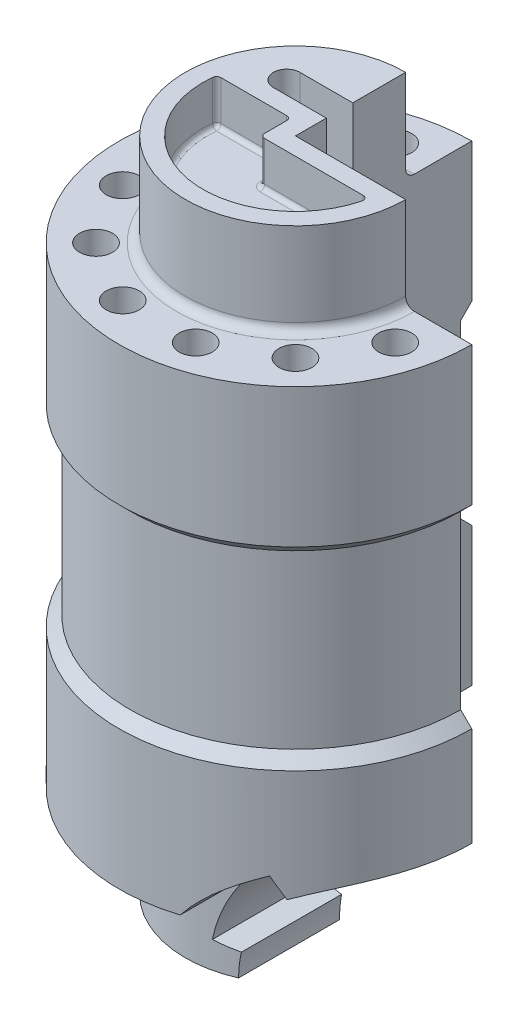
from build123d import *

# Parameters (mm, degrees)
SKETCH1_R               = 40
BOSS_EXTRUDE1_DEPTH     = 74.5
SKETCH3_R               = 40
SKETCH3_R_2             = 25
CUT_EXTRUDE1_DEPTH      = 21
CUT_EXTRUDE2_DEPTH      = 22
CUT_EXTRUDE2_DEPTH_BACK = 22
SKETCH2_R               = 40
SKETCH2_R_2             = 37.5
CUT_EXTRUDE4_DEPTH      = 160.376911753
FILLET1_R               = 2
CUT_EXTRUDE5_DEPTH      = 160.376911753
SKETCH8_R               = 3.75
CUT_EXTRUDE6_DEPTH      = 140.942845476
CUT_EXTRUDE7_DEPTH      = 94.542770966
CUT_EXTRUDE8_DEPTH      = 10
FILLET2_R               = 1
FILLET3_R               = 1


with BuildPart() as part:
    # Sketch1 → Boss-Extrude1 (new, symmetric)
    with BuildSketch(Plane(origin=(0, 0, 0), x_dir=(1, 0, 0), z_dir=(0, 1, 0))):
        with Locations(Location((0, 0, 0), (0, 0, 270))):
            Circle(SKETCH1_R)
    extrude(amount=BOSS_EXTRUDE1_DEPTH, both=True)

    # Sketch3 → Cut-Extrude1 (cut)
    with BuildSketch(Plane(origin=(0, 74.5, 0), x_dir=(1, 0, 0), z_dir=(0, 1, 0))):
        with Locations(Location((0, 0, 0), (0, 0, 270))):
            Circle(SKETCH3_R)
        with Locations(Location((0, 0, 0), (0, 0, 270))):
            Circle(SKETCH3_R_2, mode=Mode.SUBTRACT)
    cut_extrude1 = extrude(amount=-CUT_EXTRUDE1_DEPTH, mode=Mode.SUBTRACT)

    # Mirror1: Cut-Extrude1 across plane
    add(cut_extrude1.mirror(Plane.ZX), mode=Mode.SUBTRACT)

    # Sketch2 → Cut-Extrude2 (cut, two sides: drawn at the far end of the back side and taken through both)
    with BuildSketch(Plane(origin=(0, 0, 0), x_dir=(1, 0, 0), z_dir=(0, 1, 0)).offset(-CUT_EXTRUDE2_DEPTH_BACK)):
        with Locations(Location((0, 0, 0), (0, 0, 270))):
            Circle(SKETCH2_R)
        with Locations(Location((0, 0, 0), (0, 0, 90))):
            Circle(SKETCH2_R_2, mode=Mode.SUBTRACT)
    extrude(amount=CUT_EXTRUDE2_DEPTH + CUT_EXTRUDE2_DEPTH_BACK, mode=Mode.SUBTRACT)

    # Sketch5 → Cut-Extrude4 (cut, through all)
    with BuildSketch(Plane(origin=(0, 74.5, 0), x_dir=(1, 0, 0), z_dir=(0, 1, 0))):
        with BuildLine():
            Line((-12, 13), (12, 13))
            ThreePointArc((12, 13), (15, 10), (12, 7))
            Line((12, 7), (-12, 7))
            ThreePointArc((-12, 7), (-15, 10), (-12, 13))
        make_face()
    extrude(amount=-CUT_EXTRUDE4_DEPTH, mode=Mode.SUBTRACT)

    # Fillet1
    fillet1_edges = [part.edges().sort_by_distance(p)[0] for p in [
        (0, -53.5, -25),
        (0, 53.5, -25),
    ]]
    fillet(fillet1_edges, radius=FILLET1_R)

    # Sketch7 → Revolve2 (revolve)
    with BuildSketch(Plane(origin=(0, 0, 0), x_dir=(0, 0, -1), z_dir=(1, 0, 0))):
        Polygon((40, 22), (37.5, 19.5), (37.5, 22), align=None)
    revolve2 = revolve(axis=Axis((0, 103.881416882, 0), (0, -1, 0)))

    # Mirror2: Revolve2 across plane
    add(revolve2.mirror(Plane.ZX))

    # Sketch4 → Cut-Extrude5 (cut, through all)
    with BuildSketch(Plane(origin=(0, 74.5, 0), x_dir=(1, 0, 0), z_dir=(0, 1, 0))):
        with BuildLine():
            Line((0, 0), (0, 40))
            ThreePointArc((0, 40), (28.284271247, 28.284271247), (40, 0))
            Line((40, 0), (0, 0))
        make_face()
    extrude(amount=-CUT_EXTRUDE5_DEPTH, mode=Mode.SUBTRACT)

    # Sketch8 → Cut-Extrude6 (cut, through all)
    with BuildSketch(Plane(origin=(0, 53.5, 0), x_dir=(1, 0, 0), z_dir=(0, 1, 0))):
        with Locations(Location((-8.282209443, 30.909626441, 0), (0, 0, 270))):
            Circle(SKETCH8_R)
        with Locations(Location((30.909626441, -8.282209443, 0), (0, 0, 270))):
            Circle(SKETCH8_R)
        with Locations(Location((22.627416998, -22.627416998, 0), (0, 0, 270))):
            Circle(SKETCH8_R)
        with Locations(Location((8.282209443, -30.909626441, 0), (0, 0, 270))):
            Circle(SKETCH8_R)
        with Locations(Location((-8.282209443, -30.909626441, 0), (0, 0, 270))):
            Circle(SKETCH8_R)
        with Locations(Location((-22.627416998, -22.627416998, 0), (0, 0, 270))):
            Circle(SKETCH8_R)
        with Locations(Location((-30.909626441, -8.282209443, 0), (0, 0, 270))):
            Circle(SKETCH8_R)
        with Locations(Location((-30.909626441, 8.282209443, 0), (0, 0, 270))):
            Circle(SKETCH8_R)
        with Locations(Location((-22.627416998, 22.627416998, 0), (0, 0, 270))):
            Circle(SKETCH8_R)
    extrude(amount=-CUT_EXTRUDE6_DEPTH, mode=Mode.SUBTRACT)

    # Sketch10 → Cut-Extrude7 (cut, through all)
    with BuildSketch(Plane(origin=(0, 0, 0), x_dir=(-1, 0, 0), z_dir=(0, 0, -1))):
        with BuildLine():
            Line((-25.208360839, -42.779227454), (-27.321452148, -47.310766389))
            ThreePointArc((-27.321452148, -47.310766389), (-33.506811582, -45.211119786), (-40, -44.5))
            Line((-40, -44.5), (-40, -53.5))
            Line((-40, -53.5), (-27, -53.5))
            ThreePointArc((-27, -53.5), (-25.585786438, -54.085786438), (-25, -55.5))
            Line((-25, -55.5), (-25, -74.5))
            Line((-25, -74.5), (-10, -74.5))
            ThreePointArc((-10, -74.5), (-10.114159057, -71.885327718), (-10.45576741, -69.29055467))
            Line((-10.45576741, -69.29055467), (-5.531728645, -68.422313782))
            ThreePointArc((-5.531728645, -68.422313782), (-12.23263309, -53.193349985), (-25.208360839, -42.779227454))
        make_face()
    extrude(amount=-CUT_EXTRUDE7_DEPTH, mode=Mode.SUBTRACT)

    # Sketch11 → Cut-Extrude8 (cut)
    with BuildSketch(Plane(origin=(0, 74.5, 0), x_dir=(1, 0, 0), z_dir=(0, 1, 0))):
        with BuildLine():
            Line((-20.784609691, 3), (-4, 3))
            Line((-4, 3), (-4, -4))
            Line((-4, -4), (20.615528128, -4))
            ThreePointArc((20.615528128, -4), (-3.501020872, -20.706106656), (-20.784609691, 3))
        make_face()
    extrude(amount=-CUT_EXTRUDE8_DEPTH, mode=Mode.SUBTRACT)

    # Fillet2
    fillet2_edges = [part.edges().sort_by_distance(p)[0] for p in [
        (20.615528128, 69.5, 4),
        (-20.784609691, 69.5, -3),
        (-4, 69.5, -3),
        (-4, 69.5, 4),
    ]]
    fillet(fillet2_edges, radius=FILLET2_R)

    # Fillet3
    fillet3_edges = [part.edges().sort_by_distance(p)[0] for p in [
        (-3.685711089, 64.5, 20.674030419),
        (-12.449874371, 64.5, -3),
        (8.182458366, 64.5, 4),
        (-4, 64.5, 0.5),
        (20.155486146, 64.5, 4.387627564),
        (-4.292893219, 64.5, -2.707106781),
        (-20.570569135, 64.5, -2.741619849),
        (-3.707106781, 64.5, 3.707106781),
    ]]
    fillet(fillet3_edges, radius=FILLET3_R)


solid = part.part
